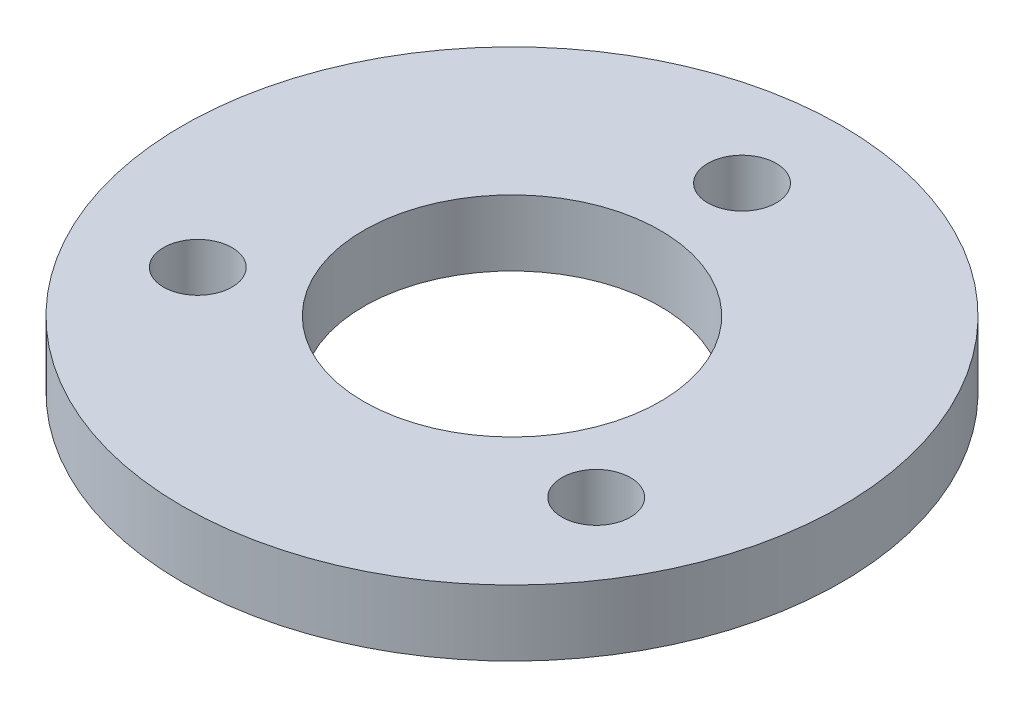
from build123d import *

# Parameters (mm, degrees)
SKETCH_1_R      = 25
SKETCH_1_R_2    = 2.6
SKETCH_1_R_3    = 11.25
EXTRUDE_1_DEPTH = 5


with BuildPart() as part:
    # 草图1 → 凸台-拉伸1 (new body)
    with BuildSketch(Plane(origin=(0, 0, 0), x_dir=(1, 0, 0), z_dir=(0, 1, 0))):
        with Locations(Location((0, 0, 0), (0, 0, 270))):
            Circle(SKETCH_1_R)
        with Locations(Location((0, 17.45, 0), (0, 0, 270))):
            Circle(SKETCH_1_R_2, mode=Mode.SUBTRACT)
        with Locations(Location((15.112143296, -8.725, 0), (0, 0, 270))):
            Circle(SKETCH_1_R_2, mode=Mode.SUBTRACT)
        with Locations(Location((-15.112143296, -8.725, 0), (0, 0, 270))):
            Circle(SKETCH_1_R_2, mode=Mode.SUBTRACT)
        with Locations(Location((0, 0, 0), (0, 0, 270))):
            Circle(SKETCH_1_R_3, mode=Mode.SUBTRACT)
    extrude(amount=EXTRUDE_1_DEPTH)


solid = part.part
